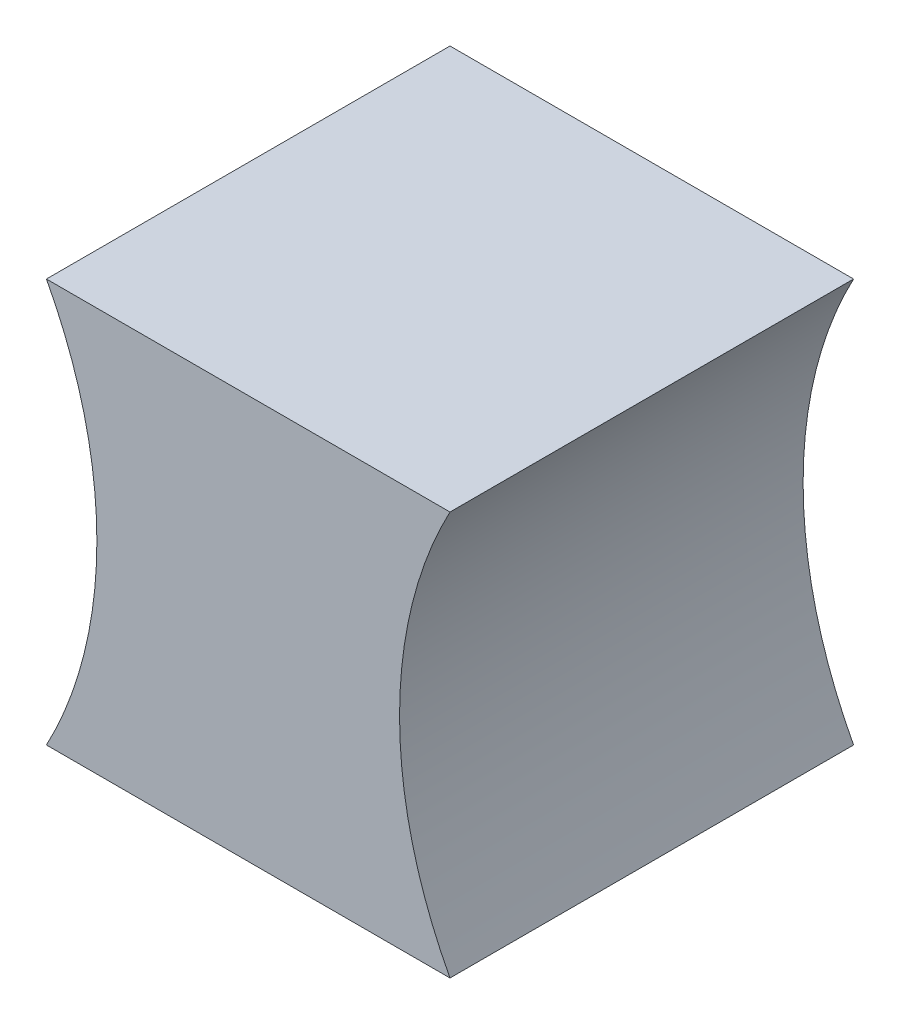
from build123d import *

# Parameters (mm, degrees)
BOSS_EXTRUDE1_DEPTH = 1000


with BuildPart() as part:
    # Sketch1 → Boss-Extrude1 (new body)
    with BuildSketch(Plane.XY):
        with BuildLine():
            Line((0, 0), (1000, 0))
            ThreePointArc((1000, 0), (875, 500), (1000, 1000))
            Line((1000, 1000), (0, 1000))
            ThreePointArc((0, 1000), (125, 500), (0, 0))
        make_face()
    extrude(amount=BOSS_EXTRUDE1_DEPTH)


solid = part.part
